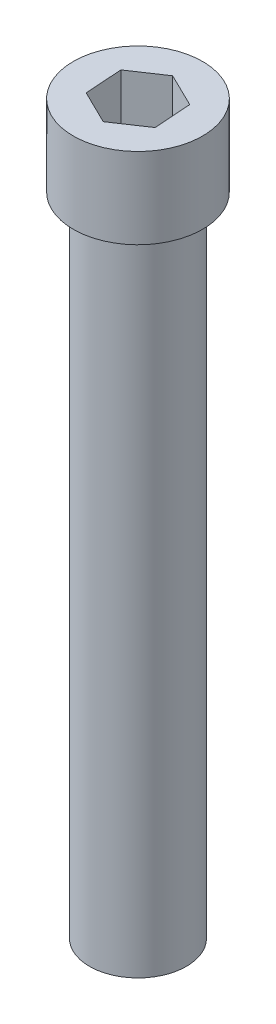
from build123d import *

# Parameters (mm, degrees)
CUT_EXTRUDE1_DEPTH = 4


with BuildPart() as part:
    # Sketch1 → Revolve1 (revolve)
    with BuildSketch(Plane.XY):
        Polygon((-4, 0), (-4, 5), (0, 5), (0, -40), (-3, -40), (-3, 0), align=None)
    revolve(axis=Axis((0, 5, 0), (0, -1, 0)))

    # Sketch2 → Cut-Extrude1 (cut)
    with BuildSketch(Plane(origin=(0, 5, 0), x_dir=(1, 0, 0), z_dir=(0, 1, 0))):
        Polygon((1.916988134, 1.287823679), (-0.156793954, 2.304072262), (-2.073782088, 1.016248584), (-1.916988134, -1.287823679), (0.156793954, -2.304072262), (2.073782088, -1.016248584), align=None)
    extrude(amount=-CUT_EXTRUDE1_DEPTH, mode=Mode.SUBTRACT)


solid = part.part
